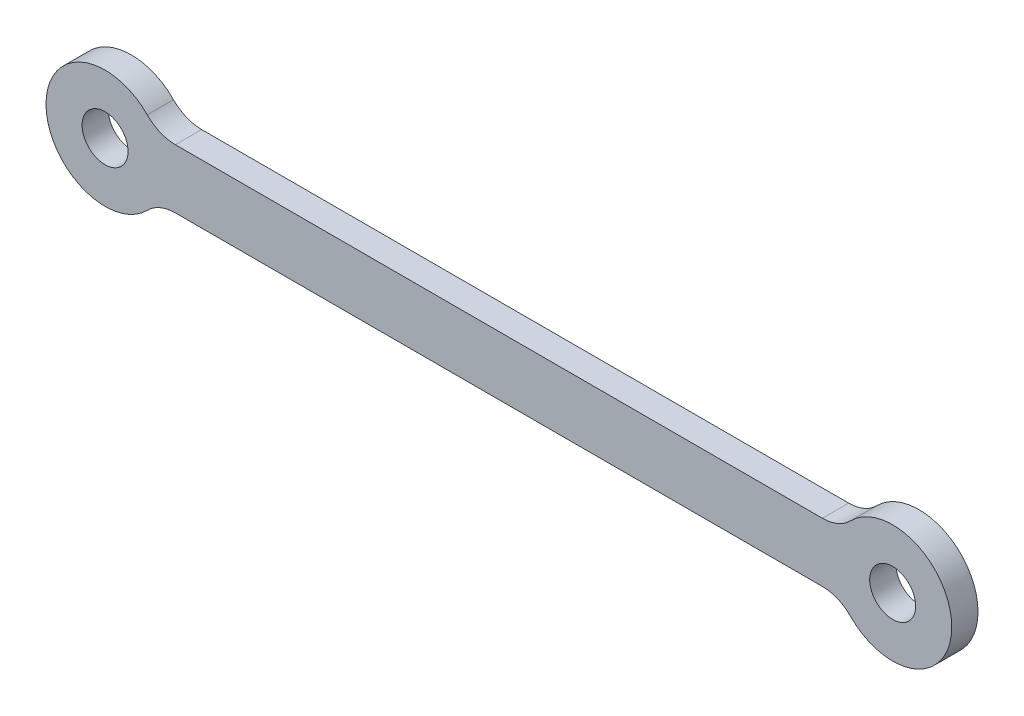
from build123d import *

# Parameters (mm, degrees)
SKETCH1_R           = 1.75
BOSS_EXTRUDE1_DEPTH = 2


with BuildPart() as part:
    # Sketch1 → Boss-Extrude1 (new body)
    with BuildSketch(Plane.XY):
        with BuildLine():
            Line((5.356071321, 2.25), (54.643928679, 2.25))
            ThreePointArc((54.643928679, 2.25), (55.805823682, 2.484136663), (56.786357207, 3.15))
            ThreePointArc((56.786357207, 3.15), (64.5, 0), (56.786357207, -3.15))
            ThreePointArc((56.786357207, -3.15), (55.805823682, -2.484136663), (54.643928679, -2.25))
            Line((54.643928679, -2.25), (5.356071321, -2.25))
            ThreePointArc((5.356071321, -2.25), (4.194176318, -2.484136663), (3.213642793, -3.15))
            ThreePointArc((3.213642793, -3.15), (-4.5, 0), (3.213642793, 3.15))
            ThreePointArc((3.213642793, 3.15), (4.194176318, 2.484136663), (5.356071321, 2.25))
        make_face()
        Circle(SKETCH1_R, mode=Mode.SUBTRACT)
        with Locations((60, 0)):
            Circle(SKETCH1_R, mode=Mode.SUBTRACT)
    extrude(amount=BOSS_EXTRUDE1_DEPTH)


solid = part.part
